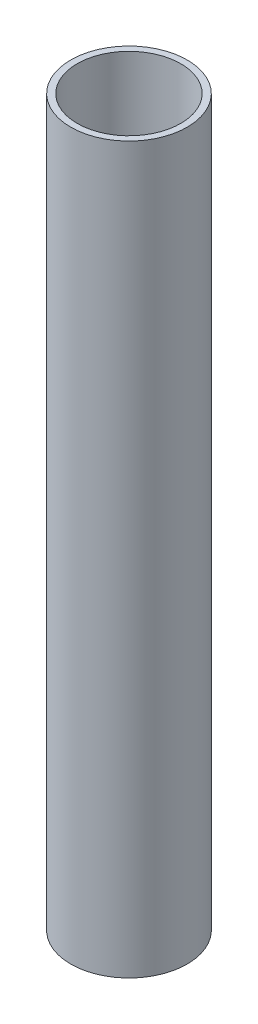
from build123d import *

# Parameters (mm, degrees)
SKETCH1_R           = 57.15
SKETCH1_R_2         = 50.8
BOSS_EXTRUDE1_DEPTH = 711.2


with BuildPart() as part:
    # Sketch1 → Boss-Extrude1 (new body)
    with BuildSketch(Plane(origin=(0, 0, 0), x_dir=(1, 0, 0), z_dir=(0, 1, 0))):
        with Locations(Location((0, 0, 0), (0, 0, 270))):
            Circle(SKETCH1_R)
        with Locations(Location((0, 0, 0), (0, 0, 270))):
            Circle(SKETCH1_R_2, mode=Mode.SUBTRACT)
    extrude(amount=BOSS_EXTRUDE1_DEPTH)


solid = part.part
